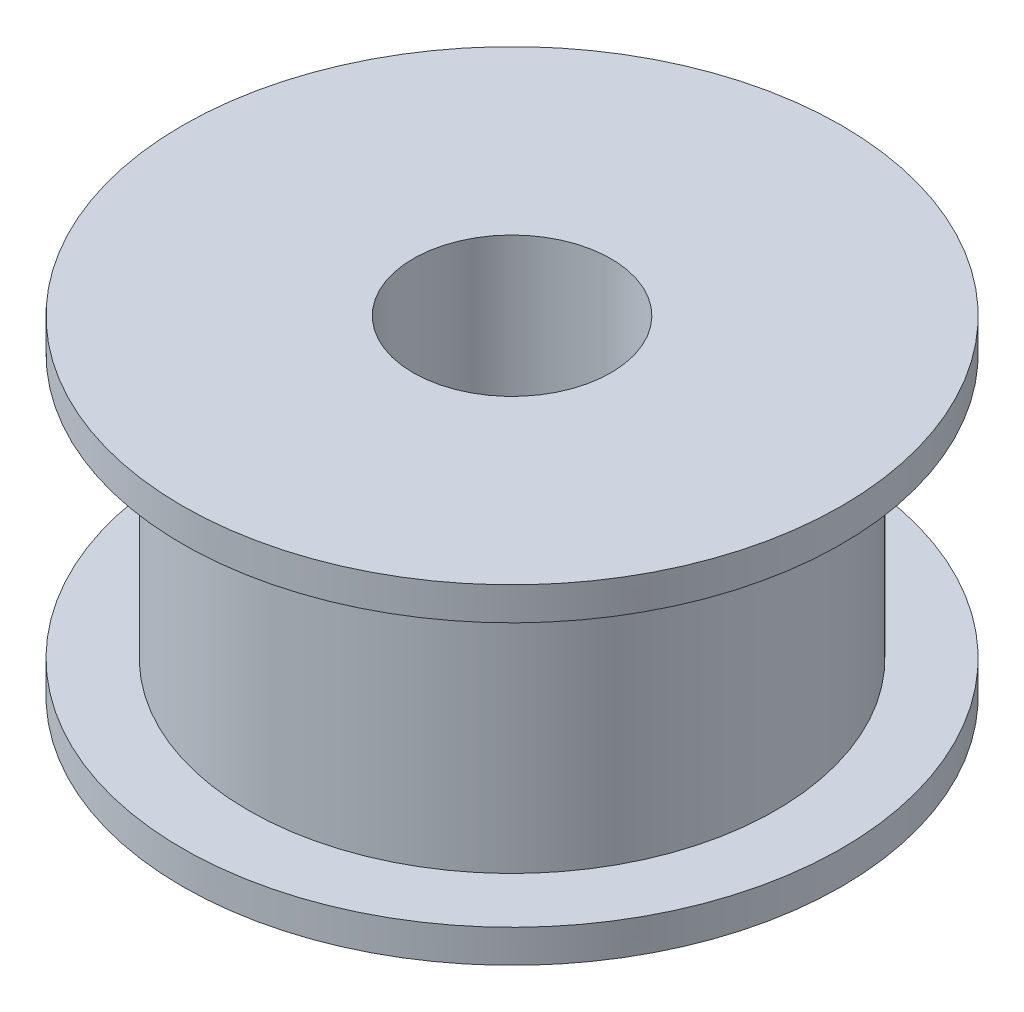
from build123d import *

# Parameters (mm, degrees)
SKETCH1_R           = 5
SKETCH1_R_2         = 1.5
BOSS_EXTRUDE1_DEPTH = 2.5
SKETCH2_W           = 1
SKETCH2_H           = 4


with BuildPart() as part:
    # Sketch1 → Boss-Extrude1 (new, symmetric)
    with BuildSketch(Plane(origin=(0, 0, 0), x_dir=(1, 0, 0), z_dir=(0, 1, 0))):
        with Locations(Location((0, 0, 0), (0, 0, 270))):
            Circle(SKETCH1_R)
        with Locations(Location((0, 0, 0), (0, 0, 270))):
            Circle(SKETCH1_R_2, mode=Mode.SUBTRACT)
    extrude(amount=BOSS_EXTRUDE1_DEPTH, both=True)

    # Sketch2 → Cut-Revolve1 (revolve, cut)
    with BuildSketch(Plane(origin=(0, 0, 0), x_dir=(0, 0, -1), z_dir=(1, 0, 0)), mode=Mode.PRIVATE) as cut_revolve1_sk:
        with Locations((-4.5, 0)):
            Rectangle(SKETCH2_W, SKETCH2_H)
    revolve(cut_revolve1_sk.sketch.rotate(Axis((0, 0, 0), (0, 1, 0)), 180), axis=Axis((0, 0, 0), (0, 1, 0)), mode=Mode.SUBTRACT)


solid = part.part
